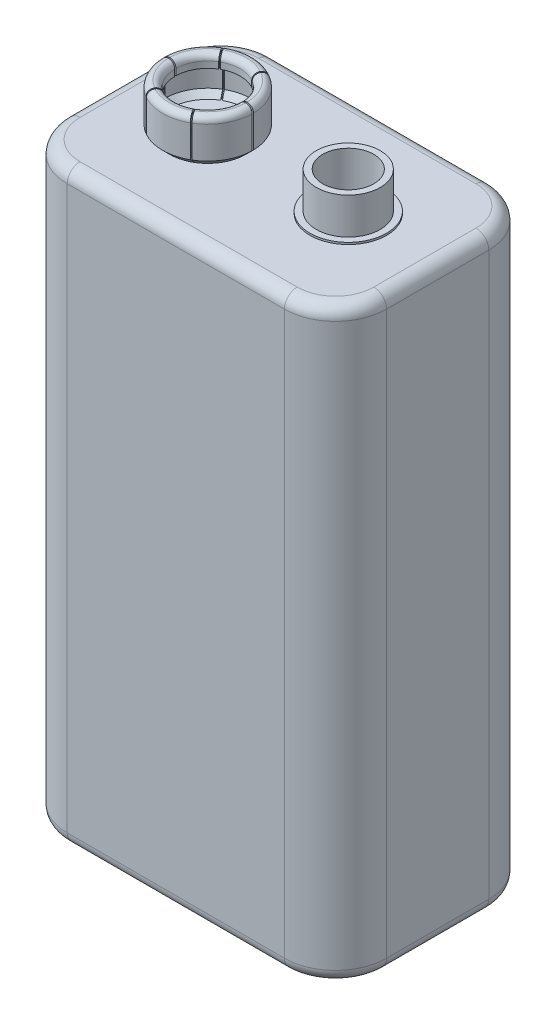
from build123d import *

# Parameters (mm, degrees)
SKETCH2_W           = 25
SKETCH2_H           = 16
BOSS_EXTRUDE1_DEPTH = 46
FILLET1_R           = 4
FILLET2_R           = 1
SKETCH3_R           = 2.5
SKETCH3_R_2         = 2
EXTRUDE_THIN1_DEPTH = 3
SKETCH6_R           = 1
BOSS_EXTRUDE2_DEPTH = 0.75
SKETCH10_W          = 1.5
SKETCH10_H          = 0.1
CUT_EXTRUDE1_DEPTH  = 49.477546349
CIRPATTERN1_COUNT   = 6
SKETCH11_R          = 3
BOSS_EXTRUDE3_DEPTH = 0.15


with BuildPart() as part:
    # Sketch2 → Boss-Extrude1 (new body)
    with BuildSketch(Plane(origin=(0, 0, 0), x_dir=(1, 0, 0), z_dir=(0, 1, 0))):
        Rectangle(SKETCH2_W, SKETCH2_H)
    extrude(amount=BOSS_EXTRUDE1_DEPTH)

    # Fillet1
    fillet1_edges = [part.edges().sort_by_distance(p)[0] for p in [
        (12.5, 23, 8),
        (-12.5, 23, 8),
        (-12.5, 23, -8),
        (12.5, 23, -8),
    ]]
    fillet(fillet1_edges, radius=FILLET1_R)

    # Fillet2
    fillet2_edges = [part.edges().sort_by_distance(p)[0] for p in [
        (-12.5, 0, 0),
        (-12.5, 46, 0),
        (12.5, 0, 0),
        (0, 0, 8),
        (0, 0, -8),
        (11.328427125, 0, 6.828427125),
        (11.328427125, 0, -6.828427125),
        (-11.328427125, 0, 6.828427125),
        (-11.328427125, 0, -6.828427125),
        (0, 46, -8),
        (12.5, 46, 0),
        (0, 46, 8),
        (11.328427125, 46, 6.828427125),
        (11.328427125, 46, -6.828427125),
        (-11.328427125, 46, 6.828427125),
        (-11.328427125, 46, -6.828427125),
    ]]
    fillet(fillet2_edges, radius=FILLET2_R)

    # Sketch3 → Extrude-Thin1 (add)
    with BuildSketch(Plane(origin=(0, 46, 0), x_dir=(1, 0, 0), z_dir=(0, 1, 0))):
        with Locations((5.5, 0)):
            Circle(SKETCH3_R)
        with Locations((5.5, 0)):
            Circle(SKETCH3_R_2, mode=Mode.SUBTRACT)
    extrude(amount=EXTRUDE_THIN1_DEPTH)

    # Sketch6 → Boss-Extrude2 (add)
    with BuildSketch(Plane(origin=(0, 46, 0), x_dir=(1, 0, 0), z_dir=(0, 1, 0))):
        with Locations(Location((-5.5, 0, 0), (0, 0, 90))):
            Circle(SKETCH6_R)
        with Locations(Location((5.5, 0, 0), (0, 0, 90))):
            Circle(SKETCH6_R)
    extrude(amount=BOSS_EXTRUDE2_DEPTH)

    # Sketch9 → Revolve-Thin1 (revolve)
    with BuildSketch(Plane.XY, mode=Mode.PRIVATE) as revolve_thin1_sk:
        with BuildLine():
            Line((-4.5, 46), (-2.5, 46))
            Line((-2.5, 46), (-1.969669914, 46.530330086))
            Line((-1.969669914, 46.530330086), (-1.969669914, 49.030330086))
            ThreePointArc((-1.969669914, 49.030330086), (-2.116202444, 49.381961465), (-2.469074773, 49.525479854))
            ThreePointArc((-2.469074773, 49.525479854), (-2.819198532, 49.380453844), (-2.964224541, 49.030330086))
            Line((-2.964224541, 49.030330086), (-2.964224541, 48.535180318))
            Line((-2.964224541, 48.535180318), (-2.814224541, 48.535180318))
            Line((-2.814224541, 48.535180318), (-2.814224541, 49.030330086))
            ThreePointArc((-2.814224541, 49.030330086), (-2.712905513, 49.274614618), (-2.468433015, 49.375479257))
            ThreePointArc((-2.468433015, 49.375479257), (-2.222041674, 49.27566845), (-2.119669914, 49.030330086))
            Line((-2.119669914, 49.030330086), (-2.119669914, 46.59246212))
            Line((-2.119669914, 46.59246212), (-2.562132034, 46.15))
            Line((-2.562132034, 46.15), (-4.5, 46.15))
            Line((-4.5, 46.15), (-4.5, 46))
        make_face()
    revolve(revolve_thin1_sk.sketch.rotate(Axis((-5.5, 46.75, 0), (0, -1, 0)), 90), axis=Axis((-5.5, 46.75, 0), (0, -1, 0)))

    # Sketch10 → Cut-Extrude1 (cut, through all)
    with BuildSketch(Plane(origin=(0, 46.15, 0), x_dir=(1, 0, 0), z_dir=(0, 1, 0))):
        with Locations((-2.469074773, 0)):
            Rectangle(SKETCH10_W, SKETCH10_H)
    cut_extrude1 = extrude(amount=CUT_EXTRUDE1_DEPTH, mode=Mode.SUBTRACT)

    # CirPattern1: Cut-Extrude1 ×6 about axis
    cirpattern1_axis = Axis((-5.5, 0, 0), (0, 1, 0))
    for i in range(1, CIRPATTERN1_COUNT):
        add(cut_extrude1.rotate(cirpattern1_axis, i * 360 / CIRPATTERN1_COUNT), mode=Mode.SUBTRACT)

    # Sketch11 → Boss-Extrude3 (add)
    with BuildSketch(Plane(origin=(0, 46, 0), x_dir=(1, 0, 0), z_dir=(0, 1, 0))):
        with Locations(Location((5.5, 0, 0), (0, 0, 90))):
            Circle(SKETCH11_R)
    extrude(amount=BOSS_EXTRUDE3_DEPTH)


solid = part.part
